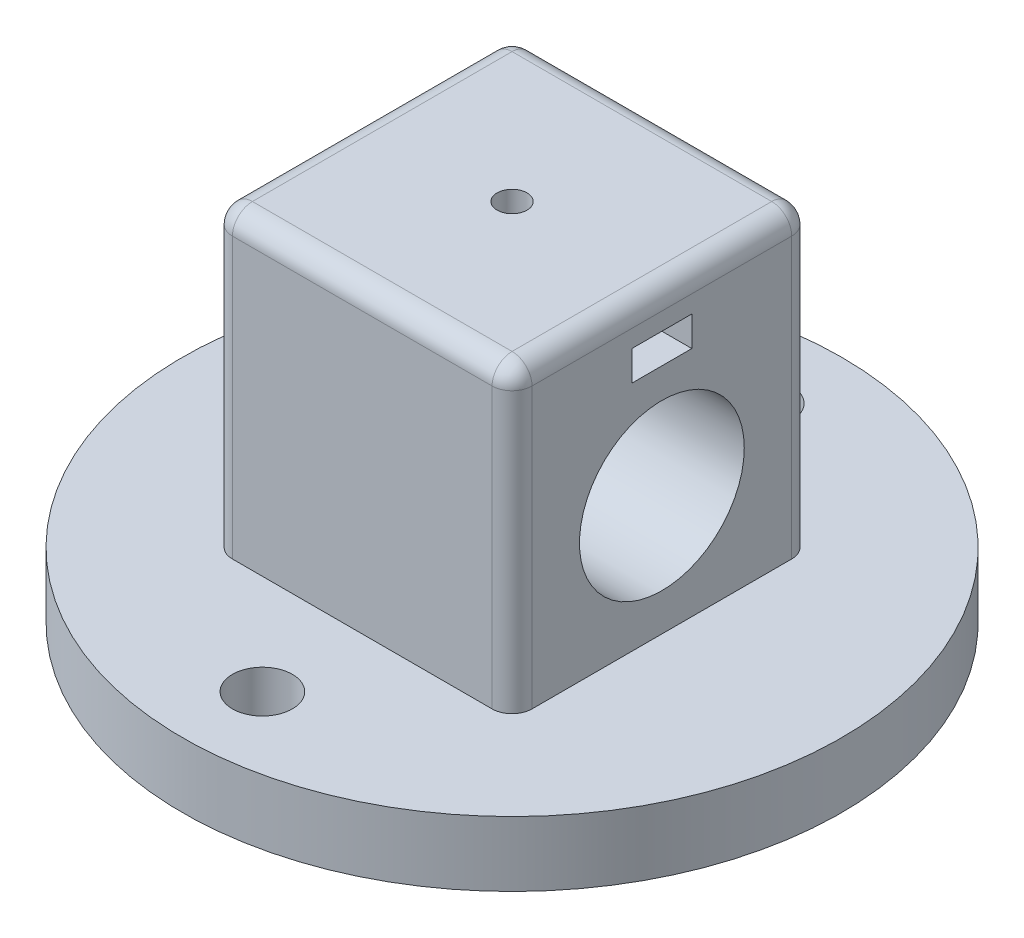
from build123d import *

# Parameters (mm, degrees)
SKETCH1_R           = 33
BOSS_EXTRUDE2_DEPTH = 6.5
SKETCH4_R           = 3
CUT_EXTRUDE1_DEPTH  = 6.5
BOSS_EXTRUDE3_DEPTH = 30
SKETCH6_R           = 8.25
CUT_EXTRUDE2_DEPTH  = 30
SKETCH8_R           = 1.5
CUT_EXTRUDE3_DEPTH  = 10
CUT_EXTRUDE4_DEPTH  = 30
FILLET12_R          = 2
FILLET13_R          = 2
FILLET14_R          = 2
FILLET15_R          = 2


with BuildPart() as part:
    # Sketch1 → Boss-Extrude2 (new body)
    with BuildSketch(Plane(origin=(0, 0, 0), x_dir=(1, 0, 0), z_dir=(0, 1, 0))):
        with Locations(Location((0, 0, 0), (0, 0, 90))):
            Circle(SKETCH1_R)
    extrude(amount=BOSS_EXTRUDE2_DEPTH)

    # Sketch4 → Cut-Extrude1 (cut)
    with BuildSketch(Plane(origin=(0, 6.5, 0), x_dir=(1, 0, 0), z_dir=(0, 1, 0))):
        with Locations(Location((0, 25, 0), (0, 0, 270))):
            Circle(SKETCH4_R)
        with Locations(Location((0, -25, 0), (0, 0, 270))):
            Circle(SKETCH4_R)
    extrude(amount=-CUT_EXTRUDE1_DEPTH, mode=Mode.SUBTRACT)

    # Sketch5 → Boss-Extrude3 (add)
    with BuildSketch(Plane(origin=(0, 6.5, 0), x_dir=(1, 0, 0), z_dir=(0, 1, 0))):
        Polygon((15, 0), (0, 0), (-15, 0), (-15, -15), (15, -15), align=None)
        Polygon((-15, 0), (0, 0), (15, 0), (15, 15), (-15, 15), align=None)
    extrude(amount=BOSS_EXTRUDE3_DEPTH)

    # Sketch6 → Cut-Extrude2 (cut)
    with BuildSketch(Plane(origin=(15, 0, 0), x_dir=(0, 0, -1), z_dir=(1, 0, 0))):
        with Locations((0, 18.5)):
            Circle(SKETCH6_R)
    extrude(amount=-CUT_EXTRUDE2_DEPTH, mode=Mode.SUBTRACT)

    # Sketch8 → Cut-Extrude3 (cut)
    with BuildSketch(Plane(origin=(0, 36.5, 0), x_dir=(1, 0, 0), z_dir=(0, 1, 0))):
        with Locations(Location((0, 0, 0), (0, 0, 270))):
            Circle(SKETCH8_R)
    extrude(amount=-CUT_EXTRUDE3_DEPTH, mode=Mode.SUBTRACT)

    # Sketch9 → Cut-Extrude4 (cut)
    with BuildSketch(Plane.ZY.offset(15)):
        Polygon((3, 32.75), (0, 32.75), (-3, 32.75), (-3, 29.75), (3, 29.75), align=None)
    extrude(amount=-CUT_EXTRUDE4_DEPTH, mode=Mode.SUBTRACT)

    # Fillet12
    fillet12_edges = [part.edges().sort_by_distance(p)[0] for p in [
        (0, 36.5, -15),
    ]]
    fillet(fillet12_edges, radius=FILLET12_R)

    # Fillet13
    fillet13_edges = [part.edges().sort_by_distance(p)[0] for p in [
        (0, 36.5, 15),
    ]]
    fillet(fillet13_edges, radius=FILLET13_R)

    # Fillet14
    fillet14_edges = [part.edges().sort_by_distance(p)[0] for p in [
        (15, 20.5, -15),
        (15, 35.914213562, -14.414213562),
        (15, 20.5, 15),
        (15, 36.5, 0),
        (15, 35.914213562, 14.414213562),
    ]]
    fillet(fillet14_edges, radius=FILLET14_R)

    # Fillet15
    fillet15_edges = [part.edges().sort_by_distance(p)[0] for p in [
        (-15, 20.5, -15),
        (-15, 36.5, 0),
        (-15, 35.914213562, -14.414213562),
        (-15, 20.5, 15),
        (-15, 35.914213562, 14.414213562),
    ]]
    fillet(fillet15_edges, radius=FILLET15_R)


solid = part.part
